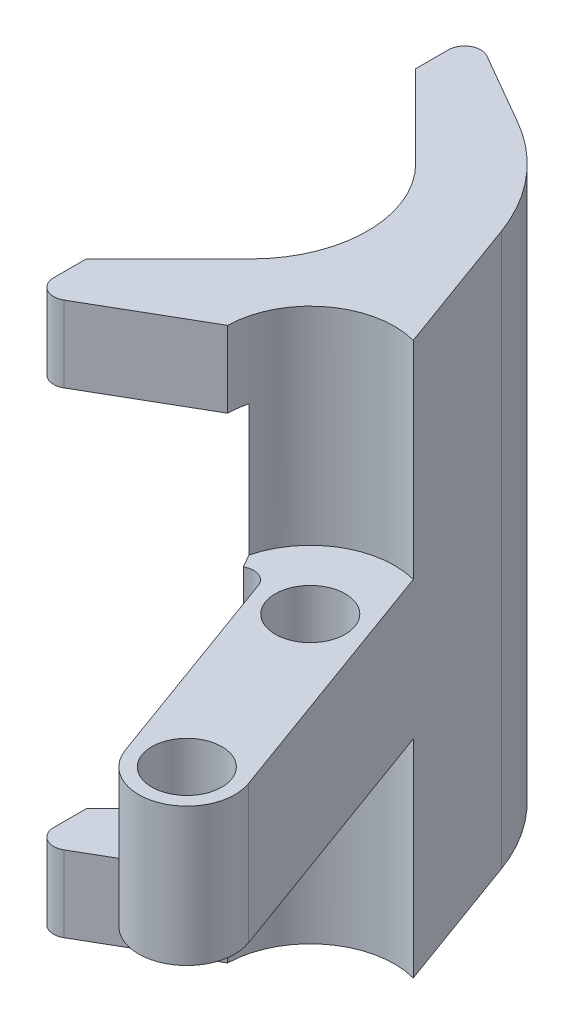
from build123d import *

# Parameters (mm, degrees)
SKETCH1_R           = 3.225
BOSS_EXTRUDE1_DEPTH = 50.8
SKETCH2_W           = 254
SKETCH2_H           = 19.05
CUT_EXTRUDE1_DEPTH  = 66.440170121
CUT_EXTRUDE4_DEPTH  = 10
SKETCH3_R           = 7.75
CUT_EXTRUDE2_DEPTH  = 58.086264546
SKETCH4_R           = 7.75
CUT_EXTRUDE3_DEPTH  = 58.086264546


with BuildPart() as part:
    # Sketch1 → Boss-Extrude1 (new body)
    with BuildSketch(Plane(origin=(0, 0, 0), x_dir=(1, 0, 0), z_dir=(0, 1, 0))):
        with BuildLine():
            Line((7.577091102, 7.577091102), (0, 15.154182204))
            Line((0, 15.154182204), (0, 18.154182204))
            ThreePointArc((0, 18.154182204), (0.75, 19.45322031), (2.25, 19.45322031))
            Line((2.25, 19.45322031), (8.985991487, 15.564193812))
            ThreePointArc((8.985991487, 15.564193812), (13.767337689, 11.552167977), (16.888139781, 6.146780193))
            Line((16.888139781, 6.146780193), (30.200329071, -30.428159285))
            ThreePointArc((30.200329071, -30.428159285), (27.555628359, -36.099738267), (21.884049378, -33.455037554))
            Line((21.884049378, -33.455037554), (14.874746988, -14.197137512))
            ThreePointArc((14.874746988, -14.197137512), (13.978238272, -13.300628796), (12.715208057, -13.411129621))
            Line((12.715208057, -13.411129621), (2.25, -19.45322031))
            ThreePointArc((2.25, -19.45322031), (0.75, -19.45322031), (0, -18.154182204))
            Line((0, -18.154182204), (0, -15.154182204))
            Line((0, -15.154182204), (7.577091102, -7.577091102))
            ThreePointArc((7.577091102, -7.577091102), (10.715625, 0), (7.577091102, 7.577091102))
        make_face()
        with Locations(Location((26.042189225, -31.94159842, 0), (0, 0, 270))):
            Circle(SKETCH1_R, mode=Mode.SUBTRACT)
        with Locations(Location((19.543806501, -14.087438625, 0), (0, 0, 270))):
            Circle(SKETCH1_R, mode=Mode.SUBTRACT)
    extrude(amount=BOSS_EXTRUDE1_DEPTH)

    # Sketch2 → Cut-Extrude1 (cut, through all)
    with BuildSketch(Plane(origin=(8.985991487, 0, 15.564193812), x_dir=(0.8660254037844355, 0, -0.5000000000000056), z_dir=(0.5000000000000056, 0, 0.8660254037844356))):
        with Locations((-1.735962308, 41.275)):
            Rectangle(SKETCH2_W, SKETCH2_H)
        with Locations((-1.735962308, 9.525)):
            Rectangle(SKETCH2_W, SKETCH2_H)
    extrude(amount=CUT_EXTRUDE1_DEPTH, mode=Mode.SUBTRACT)

    # Sketch5 → Cut-Extrude4 (cut)
    with BuildSketch(Plane(origin=(8.985991487, 0, 15.564193812), x_dir=(0.8660254037844355, 0, -0.5000000000000057), z_dir=(0.5000000000000056, 0, 0.8660254037844354))):
        Polygon((4.306128381, 7), (-7.778052996, 7), (-10.778052996, 7), (-10.778052996, 43.8), (-7.778052996, 43.8), (4.306128381, 43.8), align=None)
    extrude(amount=-CUT_EXTRUDE4_DEPTH, mode=Mode.SUBTRACT)

    # Sketch3 → Cut-Extrude2 (cut, through all)
    with BuildSketch(Plane(origin=(0, 31.75, 0), x_dir=(1, 0, 0), z_dir=(0, 1, 0))):
        with Locations((19.543806501, -14.087438625)):
            Circle(SKETCH3_R)
    extrude(amount=CUT_EXTRUDE2_DEPTH, mode=Mode.SUBTRACT)

    # Sketch4 → Cut-Extrude3 (cut, through all)
    with BuildSketch(Plane.XZ.offset(-19.05)):
        with Locations((19.543806501, 14.087438625)):
            Circle(SKETCH4_R)
    extrude(amount=CUT_EXTRUDE3_DEPTH, mode=Mode.SUBTRACT)


solid = part.part
